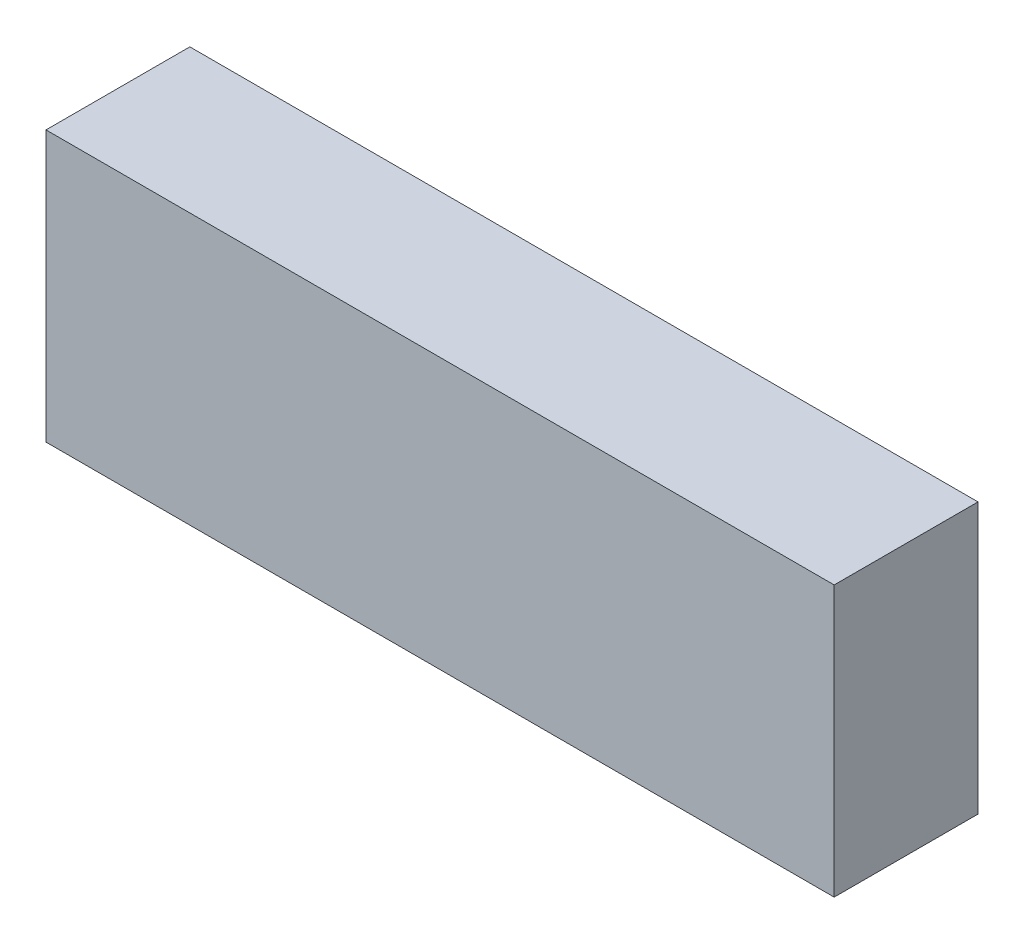
from build123d import *

# Parameters (mm, degrees)
SKETCH1_W           = 137
SKETCH1_H           = 47
BOSS_EXTRUDE1_DEPTH = 25


with BuildPart() as part:
    # Sketch1 → Boss-Extrude1 (new body)
    with BuildSketch(Plane.XY):
        with Locations((-4.445788246, 41.899672221)):
            Rectangle(SKETCH1_W, SKETCH1_H)
    extrude(amount=BOSS_EXTRUDE1_DEPTH)


solid = part.part
